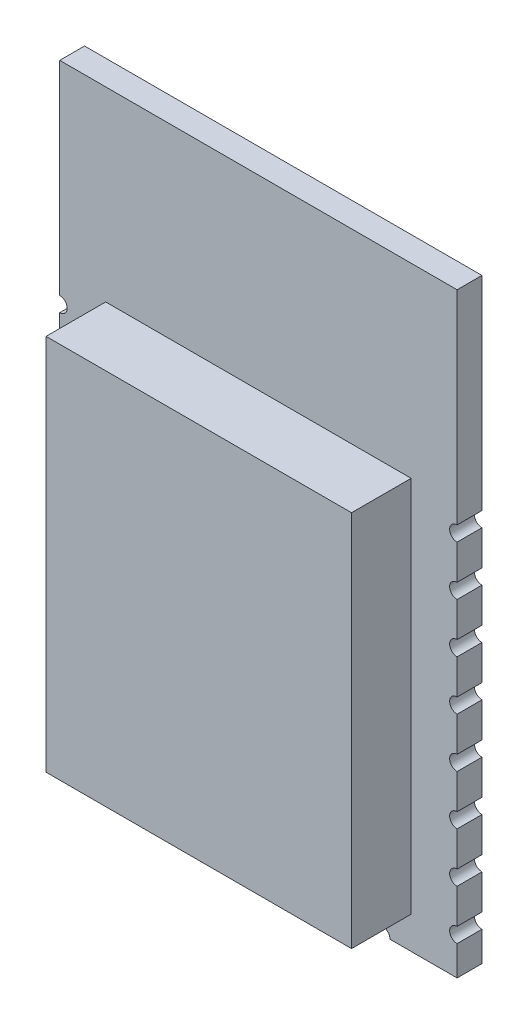
from build123d import *

# Parameters (mm, degrees)
SKETCH1_W               = 16
SKETCH1_H               = 24
BOSS_EXTRUDE1_DEPTH     = 1
SKETCH2_W               = 12.3
SKETCH2_H               = 15.2
BOSS_EXTRUDE2_DEPTH     = 2.4
SKETCH3_R               = 0.3
CUT_EXTRUDE1_DEPTH      = 15.817557154
LPATTERN1_COUNT         = 8
LPATTERN1_PITCH         = 2
MIRROR1_COPY_1_SKETCH_R = 0.3
MIRROR1_COPY_1_DEPTH    = 15.817557154
MIRROR1_COPY_2_SKETCH_R = 0.3
MIRROR1_COPY_2_DEPTH    = 15.817557154
MIRROR1_COPY_3_SKETCH_R = 0.3
MIRROR1_COPY_3_DEPTH    = 15.817557154
MIRROR1_COPY_4_SKETCH_R = 0.3
MIRROR1_COPY_4_DEPTH    = 15.817557154
MIRROR1_COPY_5_SKETCH_R = 0.3
MIRROR1_COPY_5_DEPTH    = 15.817557154
MIRROR1_COPY_6_SKETCH_R = 0.3
MIRROR1_COPY_6_DEPTH    = 15.817557154
MIRROR1_COPY_7_SKETCH_R = 0.3
MIRROR1_COPY_7_DEPTH    = 15.817557154
SKETCH4_R               = 0.3
CUT_EXTRUDE2_DEPTH      = 15.817557154
LPATTERN2_COUNT         = 6
LPATTERN2_PITCH         = 2


with BuildPart() as part:
    # Sketch1 → Boss-Extrude1 (new body)
    with BuildSketch(Plane.XY):
        Rectangle(SKETCH1_W, SKETCH1_H)
    extrude(amount=BOSS_EXTRUDE1_DEPTH)

    # Sketch2 → Boss-Extrude2 (add)
    with BuildSketch(Plane.XY.offset(1)):
        with Locations((0, -3.1)):
            Rectangle(SKETCH2_W, SKETCH2_H)
    extrude(amount=BOSS_EXTRUDE2_DEPTH)

    # Sketch3 → Cut-Extrude1 (cut, through all)
    with BuildSketch(Plane(origin=(0, 0, 0), x_dir=(-1, 0, 0), z_dir=(0, 0, -1))):
        with Locations((8, -10.5)):
            Circle(SKETCH3_R)
    cut_extrude1 = extrude(amount=-CUT_EXTRUDE1_DEPTH, mode=Mode.SUBTRACT)

    # LPattern1: Cut-Extrude1 ×8
    with Locations(*[(0, i * LPATTERN1_PITCH, 0) for i in range(1, LPATTERN1_COUNT)]):
        add(cut_extrude1, mode=Mode.SUBTRACT)

    # Mirror1: Cut-Extrude1 across plane
    add(cut_extrude1.mirror(Plane(origin=(0, 0, 0), x_dir=(0, 0, 1), z_dir=(1, 0, 0))), mode=Mode.SUBTRACT)

    # Mirror1 copy 1 sketch → Mirror1 copy 1 (cut, through all)
    with BuildSketch(Plane(origin=(0, 2, 0), x_dir=(1, 0, 0), z_dir=(0, 0, -1))):
        with Locations((8, 10.5)):
            Circle(MIRROR1_COPY_1_SKETCH_R)
    extrude(amount=-MIRROR1_COPY_1_DEPTH, mode=Mode.SUBTRACT)

    # Mirror1 copy 2 sketch → Mirror1 copy 2 (cut, through all)
    with BuildSketch(Plane(origin=(0, 4, 0), x_dir=(1, 0, 0), z_dir=(0, 0, -1))):
        with Locations((8, 10.5)):
            Circle(MIRROR1_COPY_2_SKETCH_R)
    extrude(amount=-MIRROR1_COPY_2_DEPTH, mode=Mode.SUBTRACT)

    # Mirror1 copy 3 sketch → Mirror1 copy 3 (cut, through all)
    with BuildSketch(Plane(origin=(0, 6, 0), x_dir=(1, 0, 0), z_dir=(0, 0, -1))):
        with Locations((8, 10.5)):
            Circle(MIRROR1_COPY_3_SKETCH_R)
    extrude(amount=-MIRROR1_COPY_3_DEPTH, mode=Mode.SUBTRACT)

    # Mirror1 copy 4 sketch → Mirror1 copy 4 (cut, through all)
    with BuildSketch(Plane(origin=(0, 8, 0), x_dir=(1, 0, 0), z_dir=(0, 0, -1))):
        with Locations((8, 10.5)):
            Circle(MIRROR1_COPY_4_SKETCH_R)
    extrude(amount=-MIRROR1_COPY_4_DEPTH, mode=Mode.SUBTRACT)

    # Mirror1 copy 5 sketch → Mirror1 copy 5 (cut, through all)
    with BuildSketch(Plane(origin=(0, 10, 0), x_dir=(1, 0, 0), z_dir=(0, 0, -1))):
        with Locations((8, 10.5)):
            Circle(MIRROR1_COPY_5_SKETCH_R)
    extrude(amount=-MIRROR1_COPY_5_DEPTH, mode=Mode.SUBTRACT)

    # Mirror1 copy 6 sketch → Mirror1 copy 6 (cut, through all)
    with BuildSketch(Plane(origin=(0, 12, 0), x_dir=(1, 0, 0), z_dir=(0, 0, -1))):
        with Locations((8, 10.5)):
            Circle(MIRROR1_COPY_6_SKETCH_R)
    extrude(amount=-MIRROR1_COPY_6_DEPTH, mode=Mode.SUBTRACT)

    # Mirror1 copy 7 sketch → Mirror1 copy 7 (cut, through all)
    with BuildSketch(Plane(origin=(0, 14, 0), x_dir=(1, 0, 0), z_dir=(0, 0, -1))):
        with Locations((8, 10.5)):
            Circle(MIRROR1_COPY_7_SKETCH_R)
    extrude(amount=-MIRROR1_COPY_7_DEPTH, mode=Mode.SUBTRACT)

    # Sketch4 → Cut-Extrude2 (cut, through all)
    with BuildSketch(Plane(origin=(0, 0, 0), x_dir=(-1, 0, 0), z_dir=(0, 0, -1))):
        with Locations((5, -12)):
            Circle(SKETCH4_R)
    cut_extrude2 = extrude(amount=-CUT_EXTRUDE2_DEPTH, mode=Mode.SUBTRACT)

    # LPattern2: Cut-Extrude2 ×6
    with Locations(*[(i * LPATTERN2_PITCH, 0, 0) for i in range(1, LPATTERN2_COUNT)]):
        add(cut_extrude2, mode=Mode.SUBTRACT)


solid = part.part
